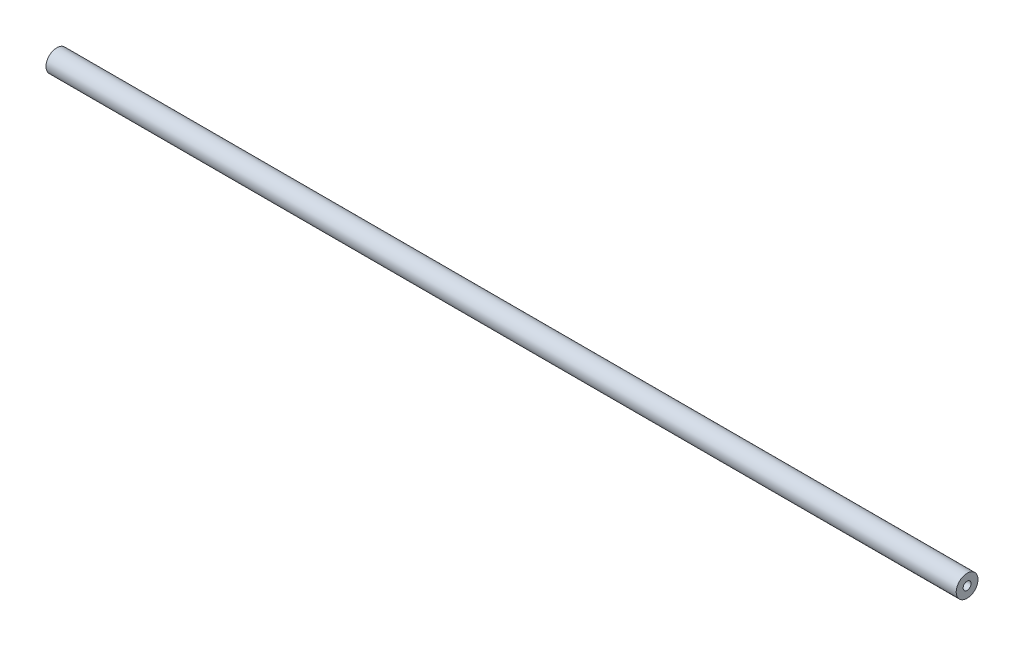
from build123d import *

# Parameters (mm, degrees)
SKETCH_1_R      = 4.5
SKETCH_1_R_2    = 1.65
EXTRUDE_1_DEPTH = 376


with BuildPart() as part:
    # 草图1 → 凸台-拉伸1 (new body)
    with BuildSketch(Plane(origin=(0, 0, 0), x_dir=(0, 0, -1), z_dir=(1, 0, 0))):
        Circle(SKETCH_1_R)
        Circle(SKETCH_1_R_2, mode=Mode.SUBTRACT)
    extrude(amount=EXTRUDE_1_DEPTH)


solid = part.part
